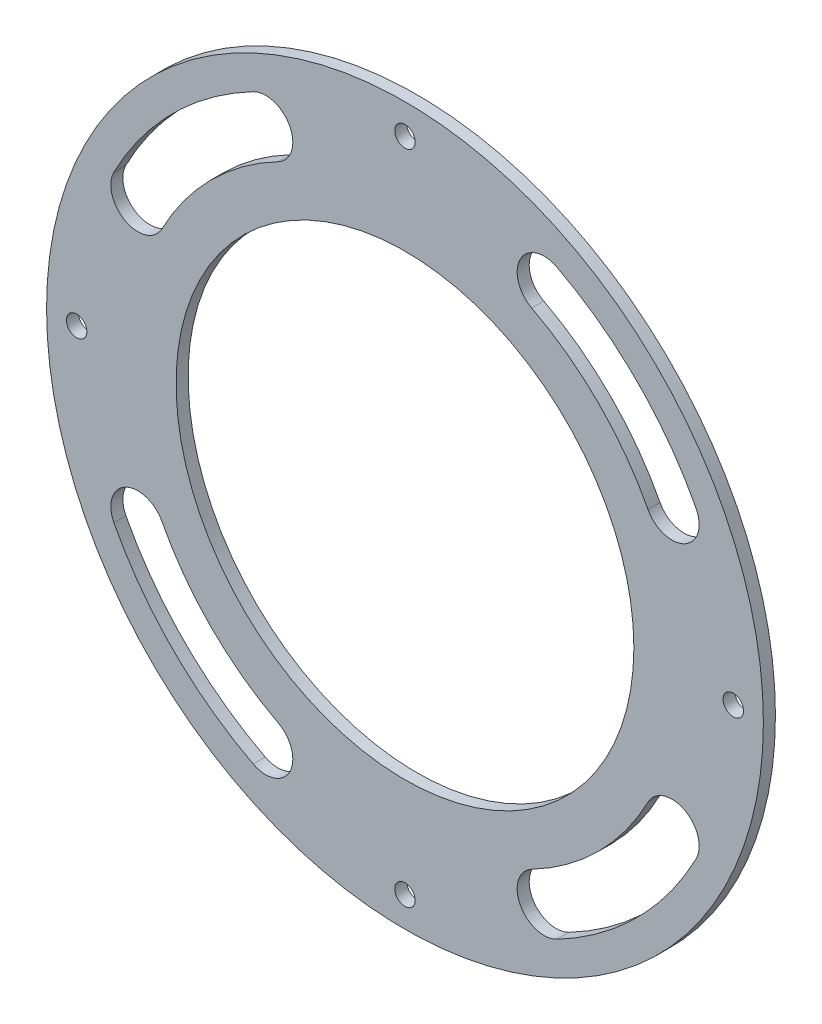
from build123d import *

# Parameters (mm, degrees)
SKETCH_1_R               = 59.5
SKETCH_1_R_2             = 1.7
EXTRUDE_4_DEPTH          = 2
SKETCH_2_R               = 38
CUT_EXTRUDE_1_DEPTH      = 2
CUT_EXTRUDE_3_DEPTH      = 2
PATTERN_CIRCULAR_2_COUNT = 4


with BuildPart() as part:
    # 草图1 → 凸台-拉伸4 (new body)
    with BuildSketch(Plane.XY):
        Circle(SKETCH_1_R)
        with Locations((0, 54.5)):
            Circle(SKETCH_1_R_2, mode=Mode.SUBTRACT)
        with Locations((54.5, 0)):
            Circle(SKETCH_1_R_2, mode=Mode.SUBTRACT)
        with Locations((0, -54.5)):
            Circle(SKETCH_1_R_2, mode=Mode.SUBTRACT)
        with Locations((-54.5, 0)):
            Circle(SKETCH_1_R_2, mode=Mode.SUBTRACT)
    extrude(amount=EXTRUDE_4_DEPTH)

    # 草图2 → 切除-拉伸1 (cut)
    with BuildSketch(Plane.XY.offset(2)):
        Circle(SKETCH_2_R)
    extrude(amount=-CUT_EXTRUDE_1_DEPTH, mode=Mode.SUBTRACT)

    # 草图4 → 切除-拉伸3 (cut)
    with BuildSketch(Plane.XY.offset(2)):
        with BuildLine():
            ThreePointArc((21.039420393, 40.34343552), (32.173358544, 32.173358544), (40.34343552, 21.039420393))
            ThreePointArc((40.34343552, 21.039420393), (46.414267423, 19.130232084), (48.323455732, 25.201063987))
            ThreePointArc((48.323455732, 25.201063987), (38.537319575, 38.537319575), (25.201063987, 48.323455732))
            ThreePointArc((25.201063987, 48.323455732), (19.130232084, 46.414267423), (21.039420393, 40.34343552))
        make_face()
    cut_extrude_3 = extrude(amount=-CUT_EXTRUDE_3_DEPTH, mode=Mode.SUBTRACT)

    # 阵列(圆周)2: 切除-拉伸3 ×4 about axis
    pattern_circular_2_axis = Axis((0, 0, 0), (0, 0, 1))
    for i in range(1, PATTERN_CIRCULAR_2_COUNT):
        add(cut_extrude_3.rotate(pattern_circular_2_axis, i * 360 / PATTERN_CIRCULAR_2_COUNT), mode=Mode.SUBTRACT)


solid = part.part
